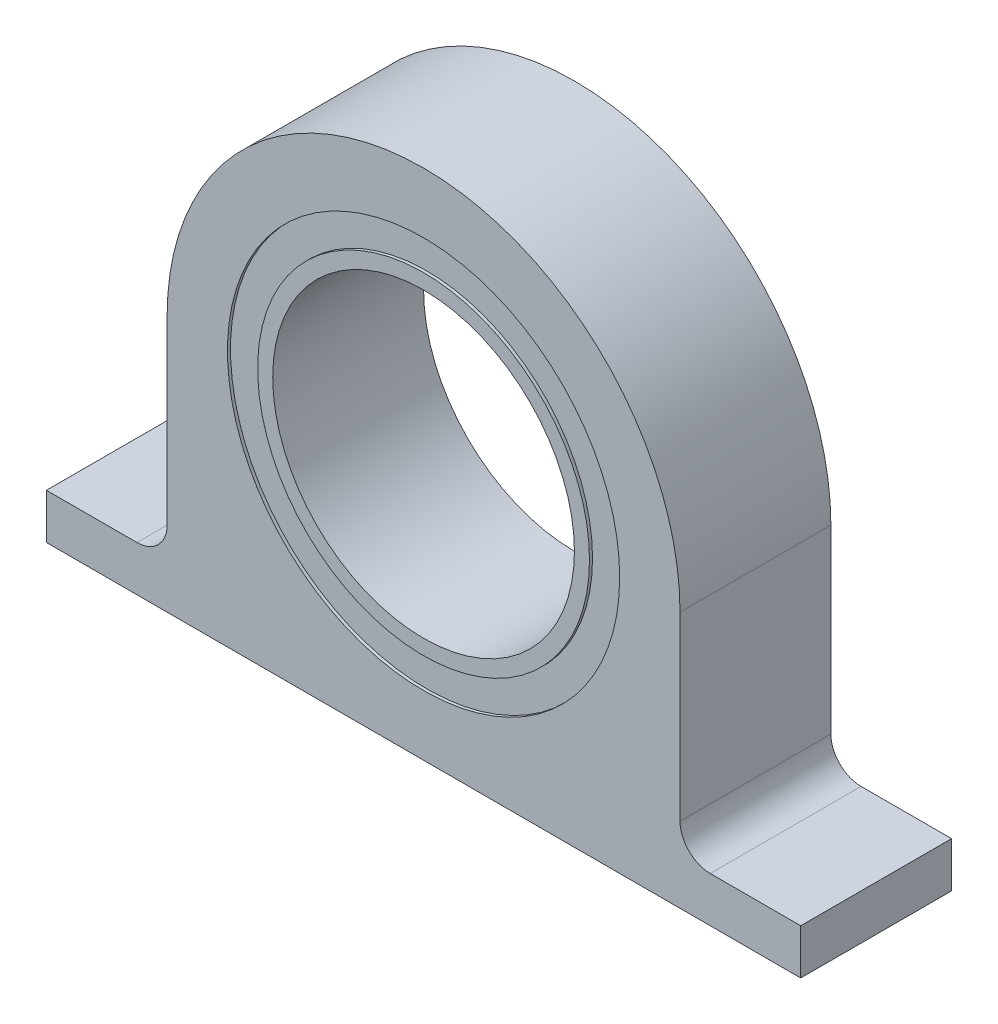
from build123d import *

# Parameters (mm, degrees)
SKETCH1_R           = 17.78
SKETCH1_R_2         = 12.7
BOSS_EXTRUDE1_DEPTH = 12.7
SKETCH2_R           = 16.51
SKETCH2_R_2         = 13.97
CUT_EXTRUDE1_DEPTH  = 0.254
SKETCH3_R           = 17.78
BOSS_EXTRUDE3_DEPTH = 12.7


with BuildPart() as part:
    # Sketch1 → Boss-Extrude1 (new body)
    with BuildSketch(Plane.XY):
        Circle(SKETCH1_R)
        Circle(SKETCH1_R_2, mode=Mode.SUBTRACT)
    extrude(amount=BOSS_EXTRUDE1_DEPTH)

    # Sketch2 → Cut-Extrude1 (cut)
    with BuildSketch(Plane.XY.offset(12.7)):
        Circle(SKETCH2_R)
        Circle(SKETCH2_R_2, mode=Mode.SUBTRACT)
    cut_extrude1 = extrude(amount=-CUT_EXTRUDE1_DEPTH, mode=Mode.SUBTRACT)

    # Mirror1: Cut-Extrude1 across plane
    add(cut_extrude1.mirror(Plane.XY.offset(6.35)), mode=Mode.SUBTRACT)

    # Sketch3 → Boss-Extrude3 (add)
    with BuildSketch(Plane.XY):
        with BuildLine():
            Line((-31.75, -21.59), (31.75, -21.59))
            Line((31.75, -21.59), (31.75, -17.78))
            Line((31.75, -17.78), (24.13, -17.78))
            ThreePointArc((24.13, -17.78), (22.333948776, -17.036051224), (21.59, -15.24))
            Line((21.59, -15.24), (21.59, 0))
            ThreePointArc((21.59, 0), (0, 21.59), (-21.59, 0))
            Line((-21.59, 0), (-21.59, -15.24))
            ThreePointArc((-21.59, -15.24), (-22.333948776, -17.036051224), (-24.13, -17.78))
            Line((-24.13, -17.78), (-31.75, -17.78))
            Line((-31.75, -17.78), (-31.75, -21.59))
        make_face()
        Circle(SKETCH3_R, mode=Mode.SUBTRACT)
    extrude(amount=BOSS_EXTRUDE3_DEPTH)


solid = part.part
